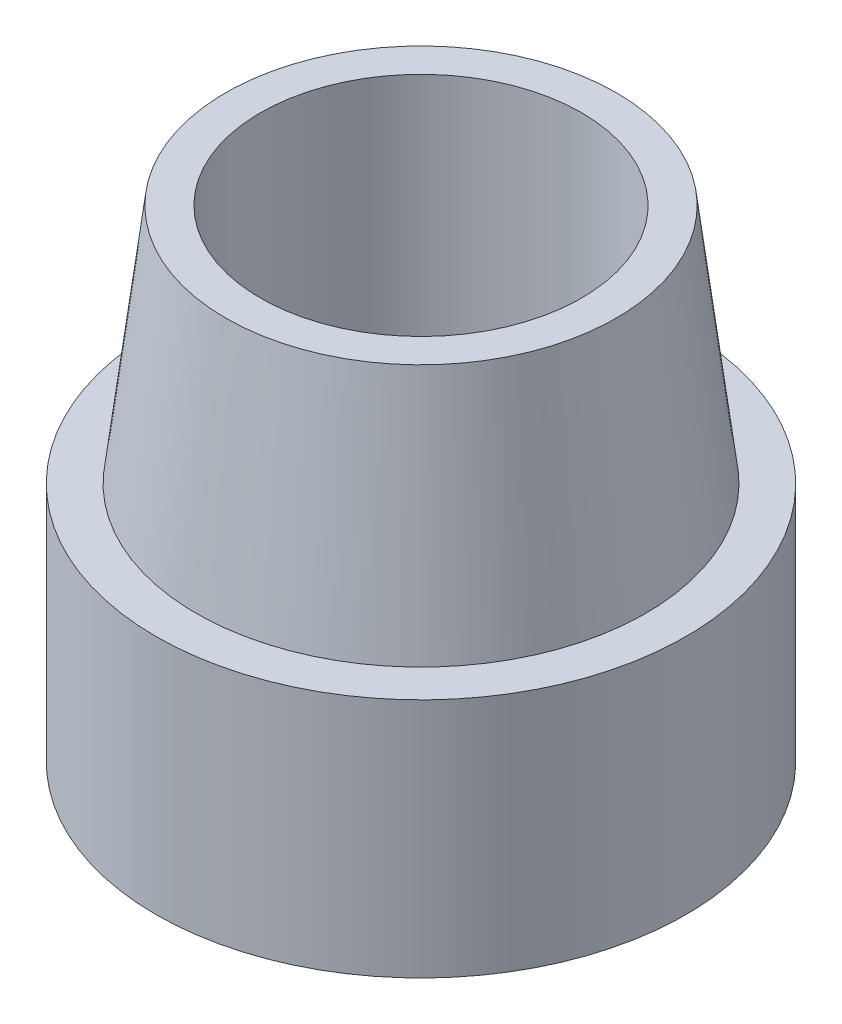
from build123d import *


with BuildPart() as part:
    # Sketch1 → Revolve1 (revolve)
    with BuildSketch(Plane.XY, mode=Mode.PRIVATE) as revolve1_sk:
        Polygon((10, 0), (10, 30), (12.16, 30), (14.001768414, 15), (16.5, 15), (16.5, 0), align=None)
    revolve(revolve1_sk.sketch.rotate(Axis((0, 0, 0), (0, 1, 0)), 90), axis=Axis((0, 0, 0), (0, 1, 0)))


solid = part.part
